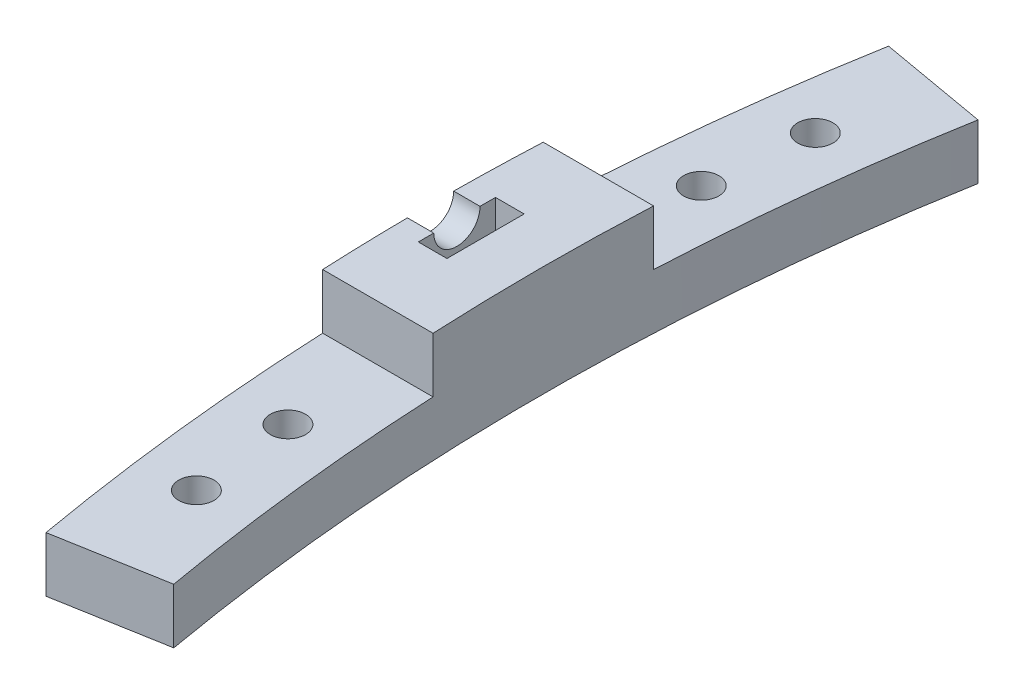
from build123d import *

# Parameters (mm, degrees)
BOSS_EXTRUDE1_DEPTH        = 5
F_3_2_3_2_DIAMETER_HOLE1_D = 3.2
BOSS_EXTRUDE2_DEPTH        = 5
SKETCH10_W                 = 7
SKETCH10_H                 = 7
CUT_EXTRUDE2_DEPTH         = 2.6
SKETCH11_R                 = 2.1
CUT_EXTRUDE3_DEPTH         = 41.33014714


with BuildPart() as part:
    # Sketch1 → Boss-Extrude1 (new body)
    with BuildSketch(Plane(origin=(0, 0, 0), x_dir=(1, 0, 0), z_dir=(0, 1, 0))):
        with BuildLine():
            Line((-216.657705663, 38.202599087), (-206.809628133, 36.46611731))
            ThreePointArc((-206.809628133, 36.46611731), (-210, 0), (-206.809628133, -36.46611731))
            Line((-206.809628133, -36.46611731), (-216.657705663, -38.202599087))
            ThreePointArc((-216.657705663, -38.202599087), (-220, 0), (-216.657705663, 38.202599087))
        make_face()
    extrude(amount=BOSS_EXTRUDE1_DEPTH)

    # Ø3.2 (3.2) Diameter Hole1 (through all)
    with Locations(Plane(origin=(0, 0, 0), x_dir=(-1, 0, 0), z_dir=(0, -1, 0))):
        with Locations((214.18186009, -18.738484691), (214.18186009, 18.738484691), (213.160645195, -28.063131327), (213.160645195, 28.063131327)):
            Hole(F_3_2_3_2_DIAMETER_HOLE1_D / 2)

    # Sketch9 → Boss-Extrude2 (add)
    with BuildSketch(Plane(origin=(0, 5, 0), x_dir=(1, 0, 0), z_dir=(0, 1, 0))):
        with BuildLine():
            Line((-219.772609758, 10), (-209.761769634, 10))
            ThreePointArc((-209.761769634, 10), (-210, 0), (-209.761769634, -10))
            Line((-209.761769634, -10), (-219.772609758, -10))
            ThreePointArc((-219.772609758, -10), (-220, 0), (-219.772609758, 10))
        make_face()
    extrude(amount=BOSS_EXTRUDE2_DEPTH)

    # Sketch10 → Cut-Extrude2 (cut)
    with BuildSketch(Plane.ZY.offset(215)):
        with Locations((0, 10)):
            Rectangle(SKETCH10_W, SKETCH10_H)
    extrude(amount=CUT_EXTRUDE2_DEPTH, mode=Mode.SUBTRACT)

    # Sketch11 → Cut-Extrude3 (cut, through all)
    with BuildSketch(Plane.ZY.offset(215)):
        with Locations((0, 10)):
            Circle(SKETCH11_R)
    extrude(amount=CUT_EXTRUDE3_DEPTH, mode=Mode.SUBTRACT)


solid = part.part
